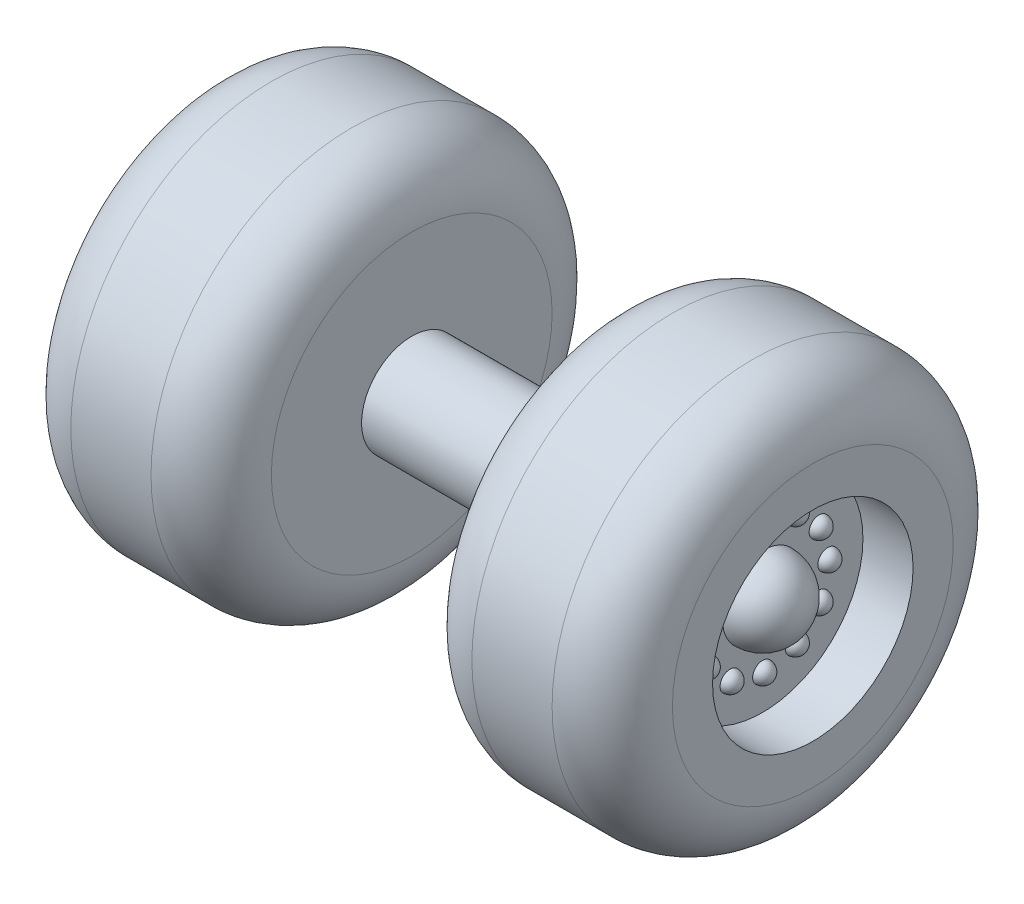
from build123d import *

# Parameters (mm, degrees)
SKETCH1_R             = 6.35
BOSS_EXTRUDE1_DEPTH   = 25.4
SKETCH2_R             = 25.4
BOSS_EXTRUDE2_DEPTH   = 25.4
SKETCH3_R             = 12.7
CUT_EXTRUDE1_DEPTH    = 6.35
REVOLVE1_ANGLE        = 180
REVOLVE2_ANGLE        = 180
CIRPATTERN2_COUNT     = 12
MIRROR1_COPY_1_ANGLE  = 180
MIRROR1_COPY_2_ANGLE  = 180
MIRROR1_COPY_3_ANGLE  = 180
MIRROR1_COPY_4_ANGLE  = 180
MIRROR1_COPY_5_ANGLE  = 180
MIRROR1_COPY_6_ANGLE  = 180
MIRROR1_COPY_7_ANGLE  = 180
MIRROR1_COPY_8_ANGLE  = 180
MIRROR1_COPY_9_ANGLE  = 180
MIRROR1_COPY_10_ANGLE = 180
MIRROR1_COPY_11_ANGLE = 180
FILLET1_R             = 7.62
FILLET2_R             = 7.62
FILLET3_R             = 7.62
FILLET4_R             = 7.62


with BuildPart() as part:
    # Sketch1 → Boss-Extrude1 (new body)
    with BuildSketch(Plane(origin=(0, 0, 0), x_dir=(0, 0, -1), z_dir=(1, 0, 0))):
        Circle(SKETCH1_R)
    extrude(amount=BOSS_EXTRUDE1_DEPTH)

    # Sketch2 → Boss-Extrude2 (add)
    with BuildSketch(Plane(origin=(0, 0, 0), x_dir=(0, 0, -1), z_dir=(1, 0, 0))):
        Circle(SKETCH2_R)
    boss_extrude2 = extrude(amount=-BOSS_EXTRUDE2_DEPTH)

    # Sketch3 → Cut-Extrude1 (cut)
    with BuildSketch(Plane(origin=(-25.4, 0, 0), x_dir=(0, 0, -1), z_dir=(1, 0, 0))):
        Circle(SKETCH3_R)
    cut_extrude1 = extrude(amount=CUT_EXTRUDE1_DEPTH, mode=Mode.SUBTRACT)

    # Sketch4 → Revolve1 (revolve)
    with BuildSketch(Plane.ZY.offset(19.05)):
        with BuildLine():
            Line((-5.08, 0), (5.08, 0))
            ThreePointArc((5.08, 0), (0, 5.08), (-5.08, 0))
        make_face()
    revolve1 = revolve(axis=Axis((-19.05, 0, -5.08), (0, 0, 1)), revolution_arc=REVOLVE1_ANGLE)

    # Sketch5 → Revolve2 (revolve)
    with BuildSketch(Plane.ZY.offset(19.05)):
        with BuildLine():
            Line((-9.525, 0), (-6.985, 0))
            ThreePointArc((-6.985, 0), (-8.255, 1.27), (-9.525, 0))
        make_face()
    revolve2 = revolve(axis=Axis((-19.05, 0, -9.525), (0, 0, 1)), revolution_arc=REVOLVE2_ANGLE)

    # CirPattern2: Revolve2 ×12 about axis
    cirpattern2_axis = Axis((0, 0, 0), (1, 0, 0))
    for i in range(1, CIRPATTERN2_COUNT):
        add(revolve2.rotate(cirpattern2_axis, i * 360 / CIRPATTERN2_COUNT))

    # Mirror1: Boss-Extrude2, Cut-Extrude1, Revolve1, Revolve2 across plane
    add(boss_extrude2.mirror(Plane(origin=(12.7, 0, 0), x_dir=(0, 0, 1), z_dir=(1, 0, 0))))
    add(cut_extrude1.mirror(Plane(origin=(12.7, 0, 0), x_dir=(0, 0, 1), z_dir=(1, 0, 0))), mode=Mode.SUBTRACT)
    add(revolve1.mirror(Plane(origin=(12.7, 0, 0), x_dir=(0, 0, 1), z_dir=(1, 0, 0))))
    add(revolve2.mirror(Plane(origin=(12.7, 0, 0), x_dir=(0, 0, 1), z_dir=(1, 0, 0))))

    # Mirror1 copy 1 sketch → Mirror1 copy 1 (revolve)
    with BuildSketch(Plane(origin=(44.45, 0, 0), x_dir=(0, -0.49999999999999994, 0.8660254037844387), z_dir=(1, 0, 0))):
        with BuildLine():
            Line((-9.525, 0), (-6.985, 0))
            ThreePointArc((-6.985, 0), (-8.255, -1.27), (-9.525, 0))
        make_face()
    revolve(axis=Axis((44.45, 4.7625, -8.248891971), (0, 0.49999999999999994, -0.8660254037844387)), revolution_arc=MIRROR1_COPY_1_ANGLE)

    # Mirror1 copy 2 sketch → Mirror1 copy 2 (revolve)
    with BuildSketch(Plane(origin=(44.45, 0, 0), x_dir=(0, -0.8660254037844386, 0.5000000000000001), z_dir=(1, 0, 0))):
        with BuildLine():
            Line((-9.525, 0), (-6.985, 0))
            ThreePointArc((-6.985, 0), (-8.255, -1.27), (-9.525, 0))
        make_face()
    revolve(axis=Axis((44.45, 8.248891971, -4.7625), (0, 0.8660254037844386, -0.5000000000000001)), revolution_arc=MIRROR1_COPY_2_ANGLE)

    # Mirror1 copy 3 sketch → Mirror1 copy 3 (revolve)
    with BuildSketch(Plane(origin=(44.45, 0, 0), x_dir=(0, -1, 0), z_dir=(1, 0, 0))):
        with BuildLine():
            Line((-9.525, 0), (-6.985, 0))
            ThreePointArc((-6.985, 0), (-8.255, -1.27), (-9.525, 0))
        make_face()
    revolve(axis=Axis((44.45, 9.525, 0), (0, 1, 0)), revolution_arc=MIRROR1_COPY_3_ANGLE)

    # Mirror1 copy 4 sketch → Mirror1 copy 4 (revolve)
    with BuildSketch(Plane(origin=(44.45, 0, 0), x_dir=(0, -0.8660254037844387, -0.4999999999999998), z_dir=(1, 0, 0))):
        with BuildLine():
            Line((-9.525, 0), (-6.985, 0))
            ThreePointArc((-6.985, 0), (-8.255, -1.27), (-9.525, 0))
        make_face()
    revolve(axis=Axis((44.45, 8.248891971, 4.7625), (0, 0.8660254037844387, 0.4999999999999998)), revolution_arc=MIRROR1_COPY_4_ANGLE)

    # Mirror1 copy 5 sketch → Mirror1 copy 5 (revolve)
    with BuildSketch(Plane(origin=(44.45, 0, 0), x_dir=(0, -0.49999999999999994, -0.8660254037844387), z_dir=(1, 0, 0))):
        with BuildLine():
            Line((-9.525, 0), (-6.985, 0))
            ThreePointArc((-6.985, 0), (-8.255, -1.27), (-9.525, 0))
        make_face()
    revolve(axis=Axis((44.45, 4.7625, 8.248891971), (0, 0.49999999999999994, 0.8660254037844387)), revolution_arc=MIRROR1_COPY_5_ANGLE)

    # Mirror1 copy 6 sketch → Mirror1 copy 6 (revolve)
    with BuildSketch(Plane(origin=(44.45, 0, 0), x_dir=(0, 0, -1), z_dir=(1, 0, 0))):
        with BuildLine():
            Line((-9.525, 0), (-6.985, 0))
            ThreePointArc((-6.985, 0), (-8.255, -1.27), (-9.525, 0))
        make_face()
    revolve(axis=Axis((44.45, 0, 9.525), (0, 0, 1)), revolution_arc=MIRROR1_COPY_6_ANGLE)

    # Mirror1 copy 7 sketch → Mirror1 copy 7 (revolve)
    with BuildSketch(Plane(origin=(44.45, 0, 0), x_dir=(0, 0.5000000000000001, -0.8660254037844386), z_dir=(1, 0, 0))):
        with BuildLine():
            Line((-9.525, 0), (-6.985, 0))
            ThreePointArc((-6.985, 0), (-8.255, -1.27), (-9.525, 0))
        make_face()
    revolve(axis=Axis((44.45, -4.7625, 8.248891971), (0, -0.5000000000000001, 0.8660254037844386)), revolution_arc=MIRROR1_COPY_7_ANGLE)

    # Mirror1 copy 8 sketch → Mirror1 copy 8 (revolve)
    with BuildSketch(Plane(origin=(44.45, 0, 0), x_dir=(0, 0.8660254037844384, -0.5000000000000004), z_dir=(1, 0, 0))):
        with BuildLine():
            Line((-9.525, 0), (-6.985, 0))
            ThreePointArc((-6.985, 0), (-8.255, -1.27), (-9.525, 0))
        make_face()
    revolve(axis=Axis((44.45, -8.248891971, 4.7625), (0, -0.8660254037844384, 0.5000000000000004)), revolution_arc=MIRROR1_COPY_8_ANGLE)

    # Mirror1 copy 9 sketch → Mirror1 copy 9 (revolve)
    with BuildSketch(Plane.YZ.offset(44.45)):
        with BuildLine():
            Line((-9.525, 0), (-6.985, 0))
            ThreePointArc((-6.985, 0), (-8.255, -1.27), (-9.525, 0))
        make_face()
    revolve(axis=Axis((44.45, -9.525, 0), (0, -1, 0)), revolution_arc=MIRROR1_COPY_9_ANGLE)

    # Mirror1 copy 10 sketch → Mirror1 copy 10 (revolve)
    with BuildSketch(Plane(origin=(44.45, 0, 0), x_dir=(0, 0.8660254037844386, 0.5000000000000001), z_dir=(1, 0, 0))):
        with BuildLine():
            Line((-9.525, 0), (-6.985, 0))
            ThreePointArc((-6.985, 0), (-8.255, -1.27), (-9.525, 0))
        make_face()
    revolve(axis=Axis((44.45, -8.248891971, -4.7625), (0, -0.8660254037844386, -0.5000000000000001)), revolution_arc=MIRROR1_COPY_10_ANGLE)

    # Mirror1 copy 11 sketch → Mirror1 copy 11 (revolve)
    with BuildSketch(Plane(origin=(44.45, 0, 0), x_dir=(0, 0.5000000000000004, 0.8660254037844384), z_dir=(1, 0, 0))):
        with BuildLine():
            Line((-9.525, 0), (-6.985, 0))
            ThreePointArc((-6.985, 0), (-8.255, -1.27), (-9.525, 0))
        make_face()
    revolve(axis=Axis((44.45, -4.7625, -8.248891971), (0, -0.5000000000000004, -0.8660254037844384)), revolution_arc=MIRROR1_COPY_11_ANGLE)

    # Fillet1
    fillet1_edges = [part.edges().sort_by_distance(p)[0] for p in [
        (-25.4, 0, 25.4),
    ]]
    fillet(fillet1_edges, radius=FILLET1_R)

    # Fillet2
    fillet2_edges = [part.edges().sort_by_distance(p)[0] for p in [
        (0, 0, 25.4),
    ]]
    fillet(fillet2_edges, radius=FILLET2_R)

    # Fillet3
    fillet3_edges = [part.edges().sort_by_distance(p)[0] for p in [
        (50.8, 0, 25.4),
    ]]
    fillet(fillet3_edges, radius=FILLET3_R)

    # Fillet4
    fillet4_edges = [part.edges().sort_by_distance(p)[0] for p in [
        (25.4, 0, 25.4),
    ]]
    fillet(fillet4_edges, radius=FILLET4_R)


solid = part.part
